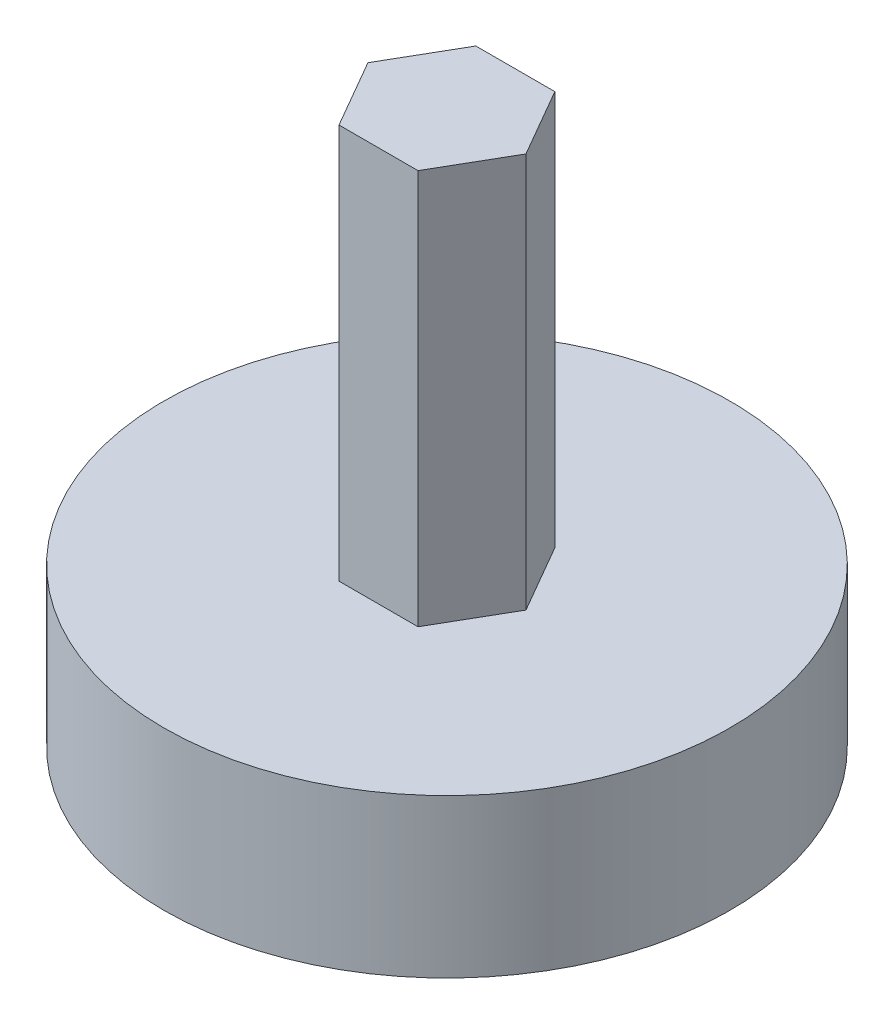
from build123d import *

# Parameters (mm, degrees)
SKETCH1_R           = 10.75
BOSS_EXTRUDE1_DEPTH = 6
BOSS_EXTRUDE2_DEPTH = 15


with BuildPart() as part:
    # Sketch1 → Boss-Extrude1 (new body)
    with BuildSketch(Plane(origin=(0, 0, 0), x_dir=(1, 0, 0), z_dir=(0, 1, 0))):
        with Locations(Location((0, 0, 0), (0, 0, 270))):
            Circle(SKETCH1_R)
    extrude(amount=BOSS_EXTRUDE1_DEPTH)

    # Sketch2 → Boss-Extrude2 (add)
    with BuildSketch(Plane(origin=(0, 6, 0), x_dir=(1, 0, 0), z_dir=(0, 1, 0))):
        Polygon((3, 0), (1.5, 2.598076211), (-1.5, 2.598076211), (-3, 0), (-1.5, -2.598076211), (1.5, -2.598076211), align=None)
    extrude(amount=BOSS_EXTRUDE2_DEPTH)


solid = part.part
